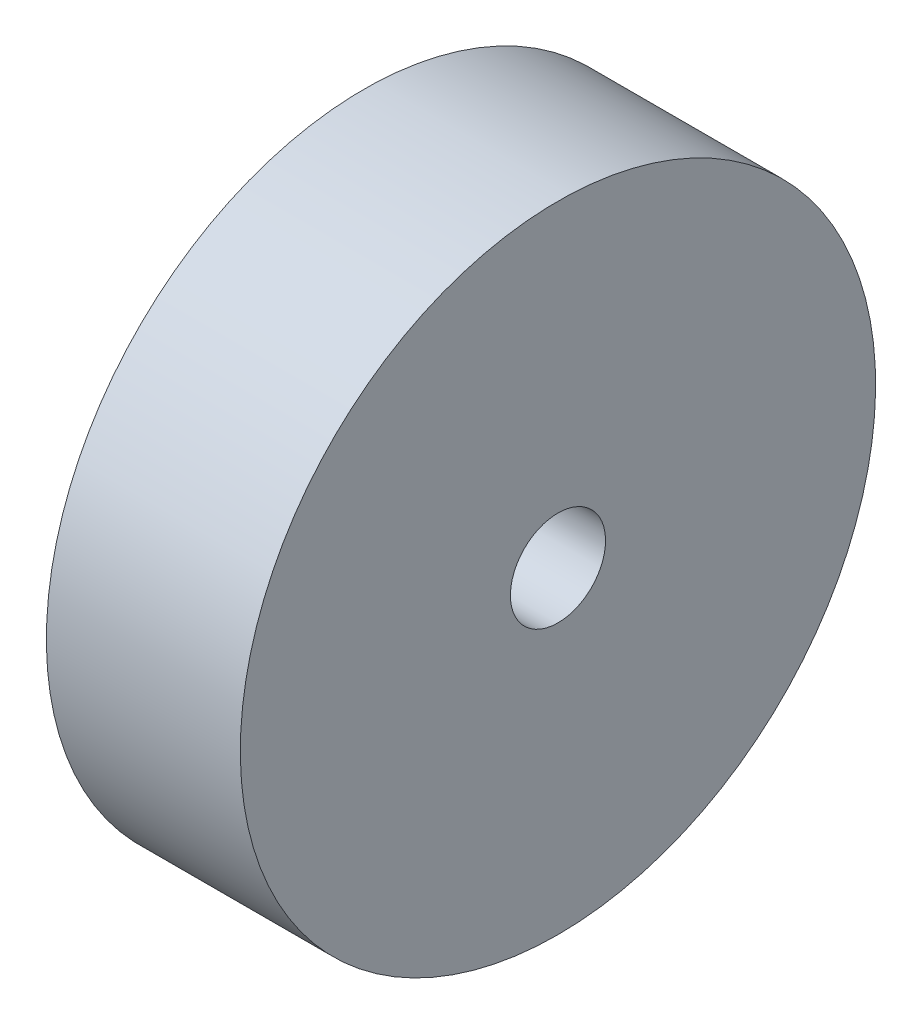
from build123d import *

# Parameters (mm, degrees)
SKETCH2_W = 26.5
SKETCH2_H = 36.9


with BuildPart() as part:
    # Sketch2 → Revolve1 (revolve)
    with BuildSketch(Plane.XY, mode=Mode.PRIVATE) as revolve1_sk:
        with Locations((0, 24.95)):
            Rectangle(SKETCH2_W, SKETCH2_H)
    revolve(revolve1_sk.sketch.rotate(Axis((-78.877853563, 0, 0), (1, 0, 0)), 180), axis=Axis((-78.877853563, 0, 0), (1, 0, 0)))


solid = part.part
